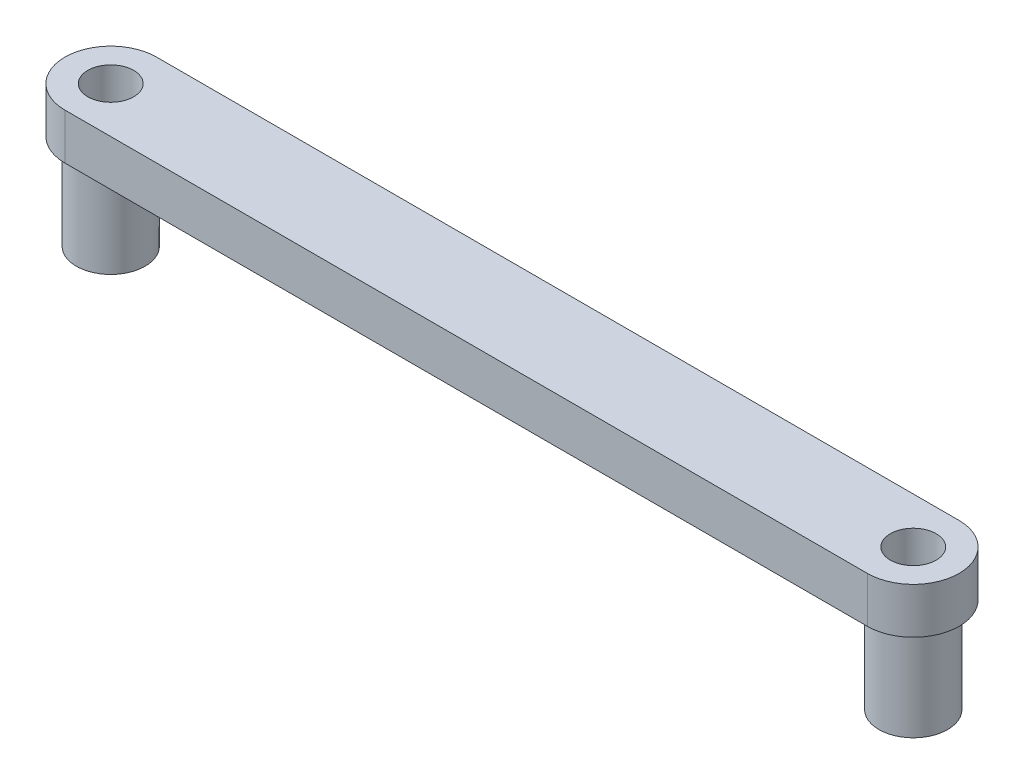
from build123d import *

# Parameters (mm, degrees)
SKETCH1_R           = 1.5
BOSS_EXTRUDE1_DEPTH = 4.15
BOSS_EXTRUDE2_DEPTH = 2
SKETCH3_R           = 1.5
BOSS_EXTRUDE3_DEPTH = 4.15
SKETCH4_R           = 1
CUT_EXTRUDE1_DEPTH  = 38.560917188


with BuildPart() as part:
    # Sketch1 → Boss-Extrude1 (new body)
    with BuildSketch(Plane(origin=(0, 0, 0), x_dir=(1, 0, 0), z_dir=(0, 1, 0))):
        with Locations(Location((0, 0, 0), (0, 0, 90))):
            Circle(SKETCH1_R)
    extrude(amount=BOSS_EXTRUDE1_DEPTH)

    # Sketch2 → Boss-Extrude2 (add)
    with BuildSketch(Plane(origin=(0, 4.15, 0), x_dir=(1, 0, 0), z_dir=(0, 1, 0))):
        with BuildLine():
            Line((35, 2), (0, 2))
            ThreePointArc((0, 2), (-2, 0), (0, -2))
            Line((0, -2), (35, -2))
            ThreePointArc((35, -2), (37, 0), (35, 2))
        make_face()
    extrude(amount=BOSS_EXTRUDE2_DEPTH)

    # Sketch3 → Boss-Extrude3 (add)
    with BuildSketch(Plane.XZ.offset(-4.15)):
        with Locations(Location((35, 0, 0), (0, 0, 90))):
            Circle(SKETCH3_R)
    extrude(amount=BOSS_EXTRUDE3_DEPTH)

    # Sketch4 → Cut-Extrude1 (cut, through all)
    with BuildSketch(Plane(origin=(0, 6.15, 0), x_dir=(1, 0, 0), z_dir=(0, 1, 0))):
        with Locations(Location((0, 0, 0), (0, 0, 270))):
            Circle(SKETCH4_R)
        with Locations(Location((35, 0, 0), (0, 0, 270))):
            Circle(SKETCH4_R)
    extrude(amount=-CUT_EXTRUDE1_DEPTH, mode=Mode.SUBTRACT)


solid = part.part
